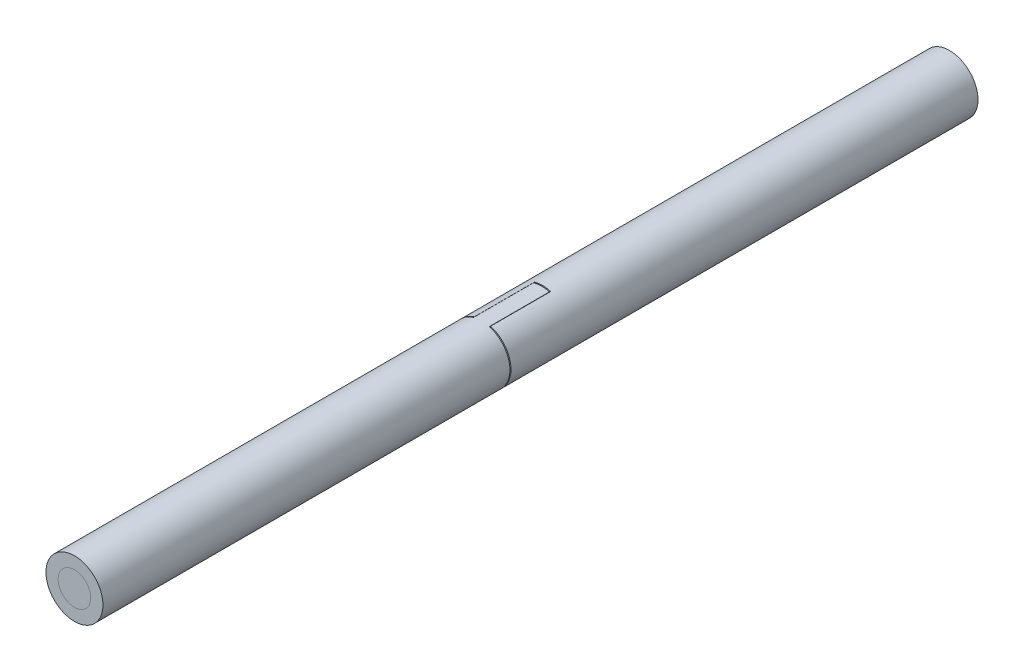
from build123d import *
from build123d.topology import SkipClean

# Parameters (mm, degrees)
SKETCH1_R           = 7
SKETCH1_R_2         = 4
BOSS_EXTRUDE1_DEPTH = 100
SKETCH2_R           = 7
SKETCH2_R_2         = 4
BOSS_EXTRUDE2_DEPTH = 100
BOSS_EXTRUDE3_START = 14.75
SKETCH3_R           = 7
SKETCH3_R_2         = 4
BOSS_EXTRUDE3_DEPTH = 14.75
CUT_EXTRUDE1_START  = 15
CUT_EXTRUDE1_DEPTH  = 15
BOSS_EXTRUDE4_DEPTH = 14.75
SKETCH6_R           = 4
BOSS_EXTRUDE5_DEPTH = 100
SKETCH7_R           = 4
BOSS_EXTRUDE6_DEPTH = 100
BOSS_EXTRUDE7_DEPTH = 14.75
BOSS_EXTRUDE8_START = 14.75
BOSS_EXTRUDE8_DEPTH = 14.75


with BuildPart() as part:
    # Sketch1 → Boss-Extrude1 (new body)
    with BuildSketch(Plane.XY.offset(-7.5)):
        Circle(SKETCH1_R)
        Circle(SKETCH1_R_2, mode=Mode.SUBTRACT)
    extrude(amount=-BOSS_EXTRUDE1_DEPTH)

    # Sketch3 → Boss-Extrude3 (add)
    with BuildSketch(Plane.XY.offset(-7.5).offset(BOSS_EXTRUDE3_START)):
        Circle(SKETCH3_R)
        Circle(SKETCH3_R_2, mode=Mode.SUBTRACT)
    extrude(amount=-BOSS_EXTRUDE3_DEPTH)

    # Sketch4 → Cut-Extrude1 (cut)
    with BuildSketch(Plane.XY.offset(-7.5).offset(CUT_EXTRUDE1_START)):
        with BuildLine():
            Line((-2, -6.708203932), (-2, 6.708203932))
            ThreePointArc((-2, 6.708203932), (0, 7), (2, 6.708203932))
            Line((2, 6.708203932), (2, -6.708203932))
            ThreePointArc((2, -6.708203932), (0, -7), (-2, -6.708203932))
        make_face()
    extrude(amount=-CUT_EXTRUDE1_DEPTH, mode=Mode.SUBTRACT)


with BuildPart() as body_2:
    # Sketch2 → Boss-Extrude2 (new body)
    with BuildSketch(Plane.XY.offset(7.5)):
        Circle(SKETCH2_R)
        Circle(SKETCH2_R_2, mode=Mode.SUBTRACT)
    extrude(amount=BOSS_EXTRUDE2_DEPTH)

    # Sketch5 → Boss-Extrude4 (add)
    with BuildSketch(Plane.XY.offset(7.5)):
        with BuildLine():
            Line((1.95, 6.722908597), (1.95, 3.492491947))
            ThreePointArc((1.95, 3.492491947), (0, 4), (-1.95, 3.492491947))
            Line((-1.95, 3.492491947), (-1.95, 6.722908597))
            ThreePointArc((-1.95, 6.722908597), (0, 7), (1.95, 6.722908597))
        make_face()
        with BuildLine():
            Line((1.95, -3.492491947), (1.95, -6.722908597))
            ThreePointArc((1.95, -6.722908597), (0, -7), (-1.95, -6.722908597))
            Line((-1.95, -6.722908597), (-1.95, -3.492491947))
            ThreePointArc((-1.95, -3.492491947), (0, -4), (1.95, -3.492491947))
        make_face()
    extrude(amount=-BOSS_EXTRUDE4_DEPTH)


with BuildPart() as body_3:
    # Sketch6 → Boss-Extrude5 (new body)
    with BuildSketch(Plane.XY.offset(-7.5)):
        Circle(SKETCH6_R)
    extrude(amount=-BOSS_EXTRUDE5_DEPTH)

    # Sketch9 → Boss-Extrude8 (add)
    with BuildSketch(Plane.XY.offset(-7.5).offset(BOSS_EXTRUDE8_START)):
        with BuildLine():
            Line((-1.95, 3.492491947), (-1.95, -3.492491947))
            ThreePointArc((-1.95, -3.492491947), (0, -4), (1.95, -3.492491947))
            Line((1.95, -3.492491947), (1.95, 3.492491947))
            ThreePointArc((1.95, 3.492491947), (0, 4), (-1.95, 3.492491947))
        make_face()
    extrude(amount=-BOSS_EXTRUDE8_DEPTH)


with BuildPart() as body_4:
    # Sketch7 → Boss-Extrude6 (new body)
    with BuildSketch(Plane.XY.offset(7.5)):
        Circle(SKETCH7_R)
    extrude(amount=BOSS_EXTRUDE6_DEPTH)

    # Sketch8 → Boss-Extrude7 (add)
    with SkipClean():  # the faces are left unmerged after this step: merging them gives an invalid solid
        with BuildSketch(Plane.XY.offset(7.5)):
            with BuildLine():
                Line((2, 3.464101615), (2, -3.464101615))
                ThreePointArc((2, -3.464101615), (4, 0), (2, 3.464101615))
            make_face()
            with BuildLine():
                Line((-2, -3.464101615), (-2, 3.464101615))
                ThreePointArc((-2, 3.464101615), (-4, 0), (-2, -3.464101615))
            make_face()
        extrude(amount=-BOSS_EXTRUDE7_DEPTH)


solid = Compound([part.part, body_2.part, body_3.part, body_4.part])
